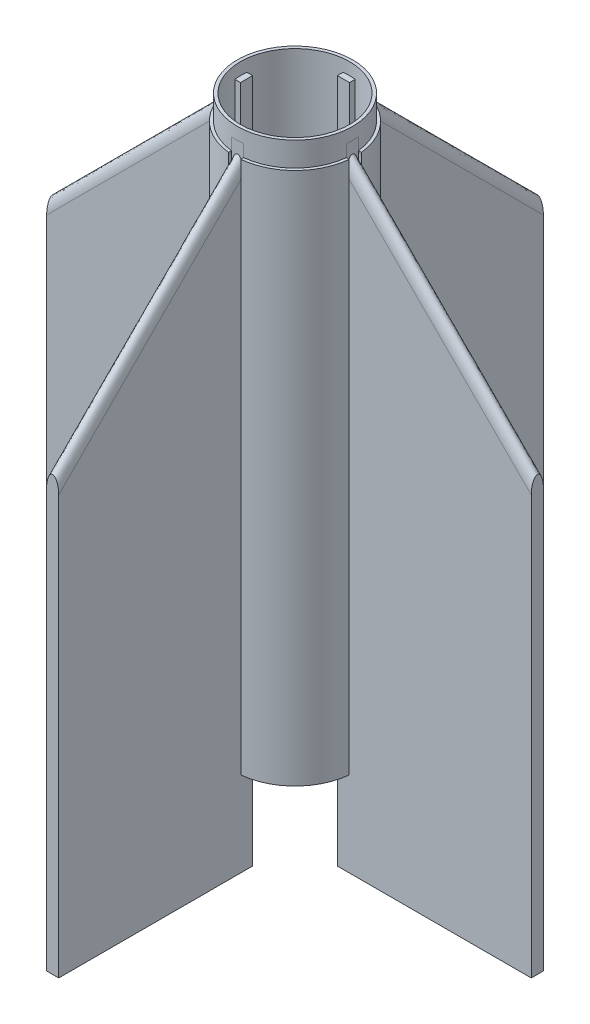
from build123d import *

# Parameters (mm, degrees)
SKETCH_1_R               = 25
SKETCH_1_R_2             = 19.15
EXTRUDE_1_DEPTH          = 40
SKETCH_2_R               = 25
SKETCH_2_R_2             = 24
EXTRUDE_2_DEPTH          = 100
SKETCH_4_R               = 25
SKETCH_4_R_2             = 19.15
EXTRUDE_3_DEPTH          = 40
SKETCH_5_R               = 25
SKETCH_5_R_2             = 22.5
EXTRUDE_4_DEPTH          = 40
SKETCH_6_R               = 23.8
SKETCH_6_R_2             = 22.5
EXTRUDE_5_DEPTH          = 10
EXTRUDE_START            = -20
SKETCH_8_W               = 5
SKETCH_8_H               = 270
EXTRUDE_6_DEPTH          = 80
SKETCH_10_W              = 80
SKETCH_10_H              = 10
CUT_EXTRUDE_2_DEPTH      = 80
CUT_EXTRUDE_3_DEPTH      = 80
PATTERN_CIRCULAR_1_COUNT = 4


with BuildPart() as part:
    # Эскиз1 → Бобышка-Вытянуть1 (new body)
    with BuildSketch(Plane(origin=(0, 0, 0), x_dir=(1, 0, 0), z_dir=(0, 1, 0))):
        with Locations(Location((0, 0, 0), (0, 0, 270))):
            Circle(SKETCH_1_R)
        with Locations(Location((0, 0, 0), (0, 0, 270))):
            Circle(SKETCH_1_R_2, mode=Mode.SUBTRACT)
    extrude(amount=EXTRUDE_1_DEPTH)

    # Эскиз2 → Бобышка-Вытянуть2 (add)
    with BuildSketch(Plane(origin=(0, 40, 0), x_dir=(1, 0, 0), z_dir=(0, 1, 0))):
        with Locations(Location((0, 0, 0), (0, 0, 270))):
            Circle(SKETCH_2_R)
        with Locations(Location((0, 0, 0), (0, 0, 270))):
            Circle(SKETCH_2_R_2, mode=Mode.SUBTRACT)
    extrude(amount=EXTRUDE_2_DEPTH)

    # Эскиз4 → Бобышка-Вытянуть3 (add)
    with BuildSketch(Plane(origin=(0, 140, 0), x_dir=(1, 0, 0), z_dir=(0, 1, 0))):
        with Locations(Location((0, 0, 0), (0, 0, 270))):
            Circle(SKETCH_4_R)
        with Locations(Location((0, 0, 0), (0, 0, 270))):
            Circle(SKETCH_4_R_2, mode=Mode.SUBTRACT)
    extrude(amount=EXTRUDE_3_DEPTH)

    # Эскиз5 → Бобышка-Вытянуть4 (add)
    with BuildSketch(Plane(origin=(0, 180, 0), x_dir=(1, 0, 0), z_dir=(0, 1, 0))):
        with Locations(Location((0, 0, 0), (0, 0, 270))):
            Circle(SKETCH_5_R)
        with Locations(Location((0, 0, 0), (0, 0, 270))):
            Circle(SKETCH_5_R_2, mode=Mode.SUBTRACT)
    extrude(amount=EXTRUDE_4_DEPTH)

    # Эскиз6 → Бобышка-Вытянуть5 (add)
    with BuildSketch(Plane(origin=(0, 220, 0), x_dir=(1, 0, 0), z_dir=(0, 1, 0))):
        with Locations(Location((0, 0, 0), (0, 0, 270))):
            Circle(SKETCH_6_R)
        with Locations(Location((0, 0, 0), (0, 0, 270))):
            Circle(SKETCH_6_R_2, mode=Mode.SUBTRACT)
    extrude(amount=EXTRUDE_5_DEPTH)

    # Эскиз8 → Бобышка-Вытянуть6 (add)
    with BuildSketch(Plane.XY.offset(EXTRUDE_START)):
        with Locations((0, 90)):
            Rectangle(SKETCH_8_W, SKETCH_8_H)
    extrude_6 = extrude(amount=-EXTRUDE_6_DEPTH)

    # Эскиз10 → Вырез-Вытянуть2 (cut)
    with BuildSketch(Plane(origin=(2.5, 0, 0), x_dir=(0, 0, -1), z_dir=(1, 0, 0))):
        with Locations((60, -40)):
            Rectangle(SKETCH_10_W, SKETCH_10_H)
    cut_extrude_2 = extrude(amount=-CUT_EXTRUDE_2_DEPTH, mode=Mode.SUBTRACT)

    # Эскиз12 → Вырез-Вытянуть3 (cut)
    with BuildSketch(Plane(origin=(2.5, 0, 0), x_dir=(0, 0, -1), z_dir=(1, 0, 0))):
        Polygon((24.874685928, 220), (23.668333275, 220), (23.668333275, 225), (100, 225), (100, 144.874685928), align=None)
    cut_extrude_3 = extrude(amount=-CUT_EXTRUDE_3_DEPTH, mode=Mode.SUBTRACT)

    # Вырез-По траектории10: sweep along a path in Эскиз13
    with BuildLine(Plane(origin=(0, 122.437342964, -122.437342964), x_dir=(1, 0, 0), z_dir=(0, 0.7071067811865489, -0.7071067811865462))) as sweep_10_path:
        Line((0, -139.680473045), (0, -31.731194723))
    # Эскиз14 → Вырез-По траектории10 (sweep, cut)
    with BuildSketch(Plane(origin=(0, 0, -23.668333275), x_dir=(-1, 0, 0), z_dir=(0, 0, -1))):
        with BuildLine():
            Line((-2.5, 214), (-2.5, 220))
            Line((-2.5, 220), (-2.5, 225))
            Line((-2.5, 225), (2.5, 225))
            Line((2.5, 225), (2.5, 220))
            Line((2.5, 220), (2.5, 214))
            add(Edge.make_bspline(
                [(2.5, 214), (2.5, 220), (0, 220), (-2.5, 220), (-2.5, 214)],
                knots=[4.71238898, 4.71238898, 4.71238898, 6.283185307, 6.283185307, 7.853981634, 7.853981634, 7.853981634], degree=2, weights=[1, 0.707106781, 1, 0.707106781, 1]))
        make_face()
    sweep_10 = sweep(path=sweep_10_path.line, mode=Mode.SUBTRACT)

    # Круговой массив1: Бобышка-Вытянуть6, Вырез-Вытянуть2, Вырез-Вытянуть3, Вырез-По траектории10 ×4 about axis
    pattern_circular_1_axis = Axis((0, 40, 0), (0, -1, 0))
    add([extrude_6.rotate(pattern_circular_1_axis, i * 360 / PATTERN_CIRCULAR_1_COUNT) for i in range(1, PATTERN_CIRCULAR_1_COUNT)])
    add([cut_extrude_2.rotate(pattern_circular_1_axis, i * 360 / PATTERN_CIRCULAR_1_COUNT) for i in range(1, PATTERN_CIRCULAR_1_COUNT)], mode=Mode.SUBTRACT)
    add([cut_extrude_3.rotate(pattern_circular_1_axis, i * 360 / PATTERN_CIRCULAR_1_COUNT) for i in range(1, PATTERN_CIRCULAR_1_COUNT)], mode=Mode.SUBTRACT)
    add([sweep_10.rotate(pattern_circular_1_axis, i * 360 / PATTERN_CIRCULAR_1_COUNT) for i in range(1, PATTERN_CIRCULAR_1_COUNT)], mode=Mode.SUBTRACT)


solid = part.part
